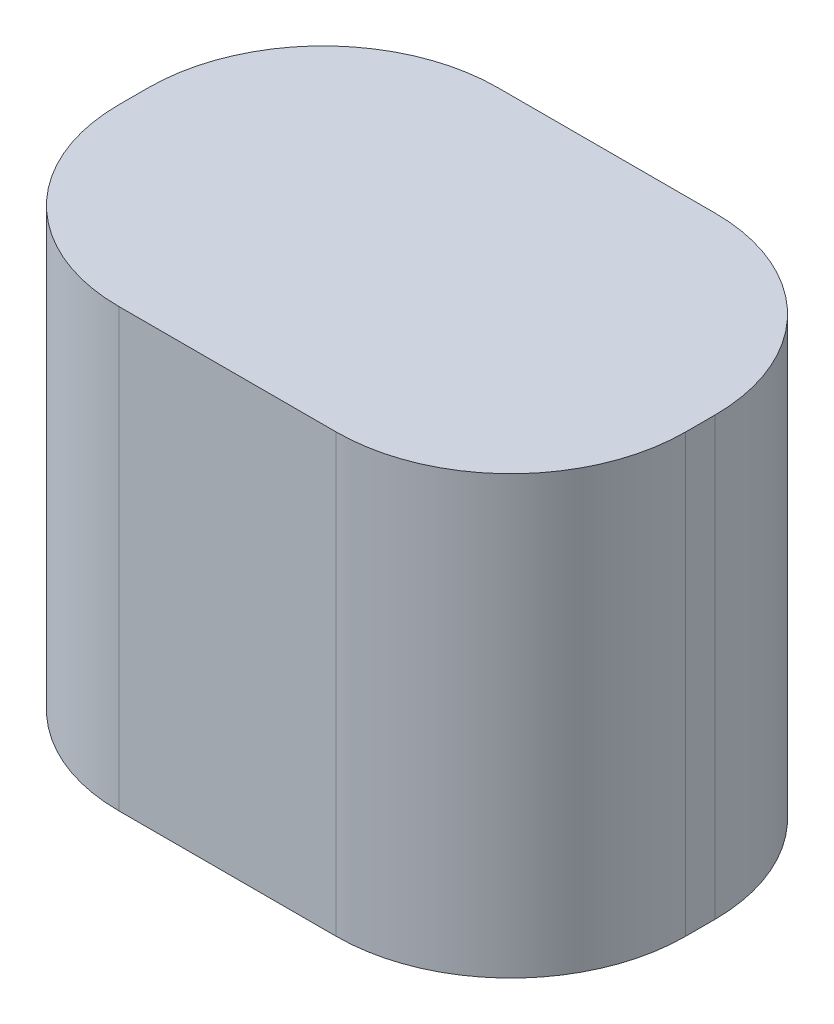
from build123d import *

# Parameters (mm, degrees)
SKETCH1_W           = 98.872985934
SKETCH1_H           = 66.119775953
BOSS_EXTRUDE1_DEPTH = 76.2
FILLET1_R           = 30.48


with BuildPart() as part:
    # Sketch1 → Boss-Extrude1 (new body)
    with BuildSketch(Plane(origin=(0, 0, 0), x_dir=(1, 0, 0), z_dir=(0, 1, 0))):
        with Locations((49.436492967, 33.059887977)):
            Rectangle(SKETCH1_W, SKETCH1_H)
    extrude(amount=BOSS_EXTRUDE1_DEPTH)

    # Fillet1
    fillet1_edges = [part.edges().sort_by_distance(p)[0] for p in [
        (0, 38.1, -66.119775953),
        (98.872985934, 38.1, -66.119775953),
        (98.872985934, 38.1, 0),
        (0, 38.1, 0),
    ]]
    fillet(fillet1_edges, radius=FILLET1_R)


solid = part.part
